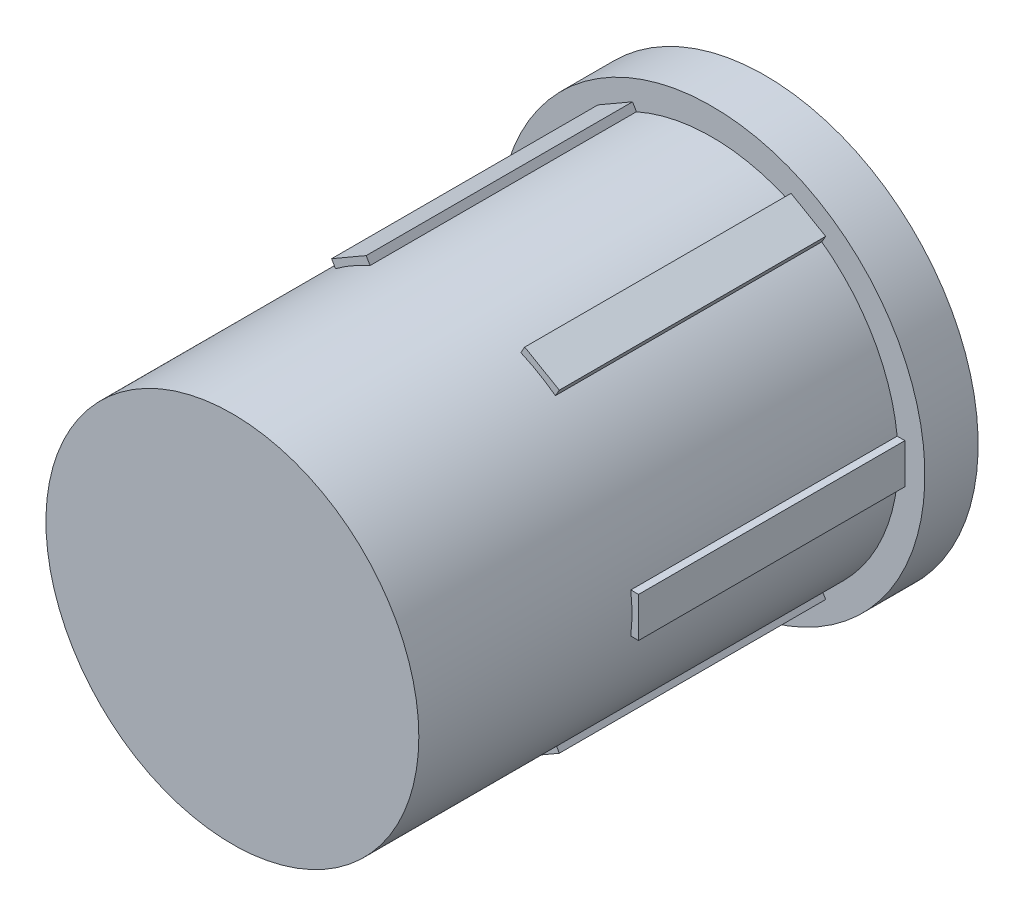
from build123d import *

# Parameters (mm, degrees)
SKETCH_1_R               = 1.4
EXTRUDE_1_DEPTH          = 3.6
SKETCH_2_R               = 1.6
EXTRUDE_2_DEPTH          = 0.4
SKETCH_3_W               = 0.120106516
SKETCH_3_H               = 2
EXTRUDE_3_DEPTH          = 0.15
PATTERN_CIRCULAR_1_COUNT = 6


with BuildPart() as part:
    # 草图1 → 凸台-拉伸1 (new body)
    with BuildSketch(Plane.XY):
        Circle(SKETCH_1_R)
    extrude(amount=EXTRUDE_1_DEPTH)

    # 草图2 → 凸台-拉伸2 (add)
    with BuildSketch(Plane(origin=(0, 0, 0), x_dir=(-1, 0, 0), z_dir=(0, 0, -1))):
        Circle(SKETCH_2_R)
    extrude(amount=EXTRUDE_2_DEPTH)

    # 草图3 → 凸台-拉伸3 (add, symmetric)
    with BuildSketch(Plane(origin=(0, 0, 0), x_dir=(1, 0, 0), z_dir=(0, 1, 0))):
        with Locations((-1.389946742, -1)):
            Rectangle(SKETCH_3_W, SKETCH_3_H)
    extrude_3 = extrude(amount=EXTRUDE_3_DEPTH, both=True)

    # 阵列(圆周)1: 凸台-拉伸3 ×6 about axis
    pattern_circular_1_axis = Axis((0, 0, 0), (0, 0, 1))
    for i in range(1, PATTERN_CIRCULAR_1_COUNT):
        add(extrude_3.rotate(pattern_circular_1_axis, i * 360 / PATTERN_CIRCULAR_1_COUNT))


solid = part.part
